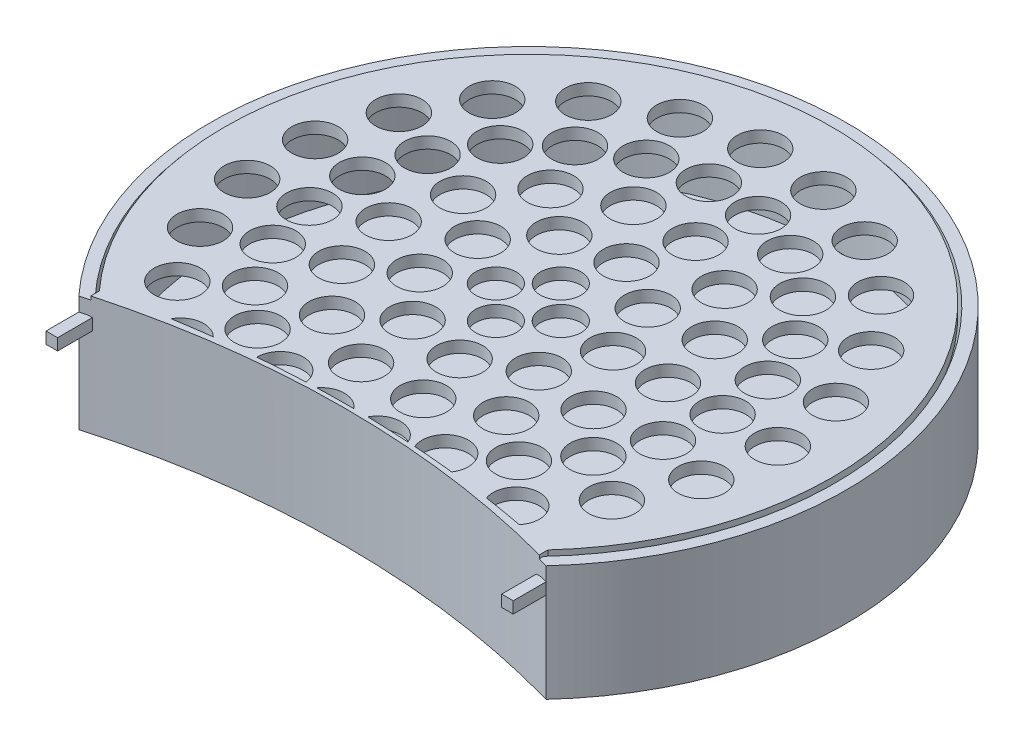
from build123d import *

# Parameters (mm, degrees)
SKETCH1_R           = 69.85
BODY_DEPTH          = 25.4
SHELL1_T            = -2.54
SKETCH3_R           = 66.675
PLATE_DEPTH         = 2.54
SKETCH5_R           = 5.08
CUT_EXTRUDE2_DEPTH  = 2.54
CIRPATTERN1_COUNT   = 23
SKETCH6_R           = 5.08
CUT_EXTRUDE3_DEPTH  = 2.54
CIRPATTERN2_COUNT   = 14
SKETCH7_R           = 5.08
CUT_EXTRUDE4_DEPTH  = 2.54
CIRPATTERN3_COUNT   = 9
SKETCH8_R           = 4.445
CUT_EXTRUDE5_DEPTH  = 2.54
CIRPATTERN4_COUNT   = 4
BOSS_EXTRUDE1_DEPTH = 25.4
CIRCLE_CUT_DEPTH    = 63.5
CUT_EXTRUDE6_DEPTH  = 63.5
SKETCH12_W          = 2.54
SKETCH12_H          = 2.54
CONNECTORS_DEPTH    = 7.62


with BuildPart() as part:
    # Sketch1 → Body (new body)
    with BuildSketch(Plane(origin=(0, 0, 0), x_dir=(1, 0, 0), z_dir=(0, 1, 0))):
        with Locations(Location((0, 0, 0), (0, 0, 270))):
            Circle(SKETCH1_R)
    extrude(amount=BODY_DEPTH)

    # Shell1
    shell1_openings = [part.faces().sort_by_distance(p)[0] for p in [
        (0, 25.4, 0),
    ]]
    offset(amount=SHELL1_T, openings=shell1_openings, kind=Kind.INTERSECTION)



with BuildPart() as body_2:
    # Sketch3 → plate (new body)
    with BuildSketch(Plane(origin=(0, 26.162, 0), x_dir=(1, 0, 0), z_dir=(0, 1, 0))):
        with Locations(Location((0, 0, 0), (0, 0, 270))):
            Circle(SKETCH3_R)
    extrude(amount=-PLATE_DEPTH)

    # Sketch5 → Cut-Extrude2 (cut)
    with BuildSketch(Plane(origin=(0, 26.162, 0), x_dir=(1, 0, 0), z_dir=(0, 1, 0))):
        with Locations(Location((54.789530839, 0, 0), (0, 0, 270))):
            Circle(SKETCH5_R)
        with Locations(Location((42.654572856, 0, 0), (0, 0, 270))):
            Circle(SKETCH5_R)
    cut_extrude2 = extrude(amount=-CUT_EXTRUDE2_DEPTH, mode=Mode.SUBTRACT)

    # CirPattern1: Cut-Extrude2 ×23 about axis
    cirpattern1_axis = Axis((0, 0, 0), (0, 1, 0))
    for i in range(1, CIRPATTERN1_COUNT):
        add(cut_extrude2.rotate(cirpattern1_axis, i * 360 / CIRPATTERN1_COUNT), mode=Mode.SUBTRACT)

    # Sketch6 → Cut-Extrude3 (cut)
    with BuildSketch(Plane(origin=(0, 26.162, 0), x_dir=(1, 0, 0), z_dir=(0, 1, 0))):
        with Locations(Location((30.667157657, 0, 0), (0, 0, 270))):
            Circle(SKETCH6_R)
    cut_extrude3 = extrude(amount=-CUT_EXTRUDE3_DEPTH, mode=Mode.SUBTRACT)

    # CirPattern2: Cut-Extrude3 ×14 about axis
    cirpattern2_axis = Axis((0, 0, 0), (0, 1, 0))
    for i in range(1, CIRPATTERN2_COUNT):
        add(cut_extrude3.rotate(cirpattern2_axis, i * 360 / CIRPATTERN2_COUNT), mode=Mode.SUBTRACT)

    # Sketch7 → Cut-Extrude4 (cut)
    with BuildSketch(Plane(origin=(0, 26.162, 0), x_dir=(1, 0, 0), z_dir=(0, 1, 0))):
        with Locations(Location((18.602614166, 0, 0), (0, 0, 270))):
            Circle(SKETCH7_R)
    cut_extrude4 = extrude(amount=-CUT_EXTRUDE4_DEPTH, mode=Mode.SUBTRACT)

    # CirPattern3: Cut-Extrude4 ×9 about axis
    cirpattern3_axis = Axis((0, 0, 0), (0, 1, 0))
    for i in range(1, CIRPATTERN3_COUNT):
        add(cut_extrude4.rotate(cirpattern3_axis, i * 360 / CIRPATTERN3_COUNT), mode=Mode.SUBTRACT)

    # Sketch8 → Cut-Extrude5 (cut)
    with BuildSketch(Plane(origin=(0, 26.162, 0), x_dir=(1, 0, 0), z_dir=(0, 1, 0))):
        with Locations(Location((7.129637739, 0, 0), (0, 0, 270))):
            Circle(SKETCH8_R)
    cut_extrude5 = extrude(amount=-CUT_EXTRUDE5_DEPTH, mode=Mode.SUBTRACT)

    # CirPattern4: Cut-Extrude5 ×4 about axis
    cirpattern4_axis = Axis((0, 0, 0), (0, 1, 0))
    for i in range(1, CIRPATTERN4_COUNT):
        add(cut_extrude5.rotate(cirpattern4_axis, i * 360 / CIRPATTERN4_COUNT), mode=Mode.SUBTRACT)


with BuildPart() as part_1:
    add(part.part)

    add(body_2.part)  # Boss-Extrude1 merges body 2
    # Sketch13 → Boss-Extrude1 (add, symmetric)
    with BuildSketch(Plane(origin=(0, 25.4, 0), x_dir=(1, 0, 0), z_dir=(0, 1, 0))):
        with BuildLine():
            Line((49.237524928, -86.868), (-49.237524928, -86.868))
            Line((-49.237524928, -86.868), (-49.237524928, -44.958))
            ThreePointArc((-49.237524928, -44.958), (0, -39.388206386), (49.237524928, -44.958))
            Line((49.237524928, -44.958), (49.237524928, -86.868))
        make_face()
    extrude(amount=BOSS_EXTRUDE1_DEPTH, both=True)

    # Sketch9 → circle cut (cut, symmetric)
    with BuildSketch(Plane(origin=(0, 0, 0), x_dir=(1, 0, 0), z_dir=(0, 1, 0))):
        with BuildLine():
            Line((69.85, -86.892577), (-69.85, -86.892577))
            Line((-69.85, -86.892577), (-69.85, -53.720370546))
            ThreePointArc((-69.85, -53.720370546), (0, -40.286677853), (69.85, -53.720370546))
            Line((69.85, -53.720370546), (69.85, -86.892577))
        make_face()
    extrude(amount=CIRCLE_CUT_DEPTH, both=True, mode=Mode.SUBTRACT)

    # Sketch14 → Cut-Extrude6 (cut, symmetric)
    with BuildSketch(Plane(origin=(0, 0, 0), x_dir=(0, 0, -1), z_dir=(1, 0, 0))):
        Polygon((-23.267075151, 26.162), (-48.667075151, 26.162), (-48.667075151, 52.593802599), (-39.427592482, 52.593802599), align=None)
    extrude(amount=CUT_EXTRUDE6_DEPTH, both=True, mode=Mode.SUBTRACT)

    # Sketch12 → connectors (add)
    with BuildSketch(Plane.XY.offset(46.99)):
        with Locations((-50.027909309, 21.082)):
            Rectangle(SKETCH12_W, SKETCH12_H)
        with Locations((50.027909309, 21.082)):
            Rectangle(SKETCH12_W, SKETCH12_H)
    extrude(amount=CONNECTORS_DEPTH)


solid = part_1.part
